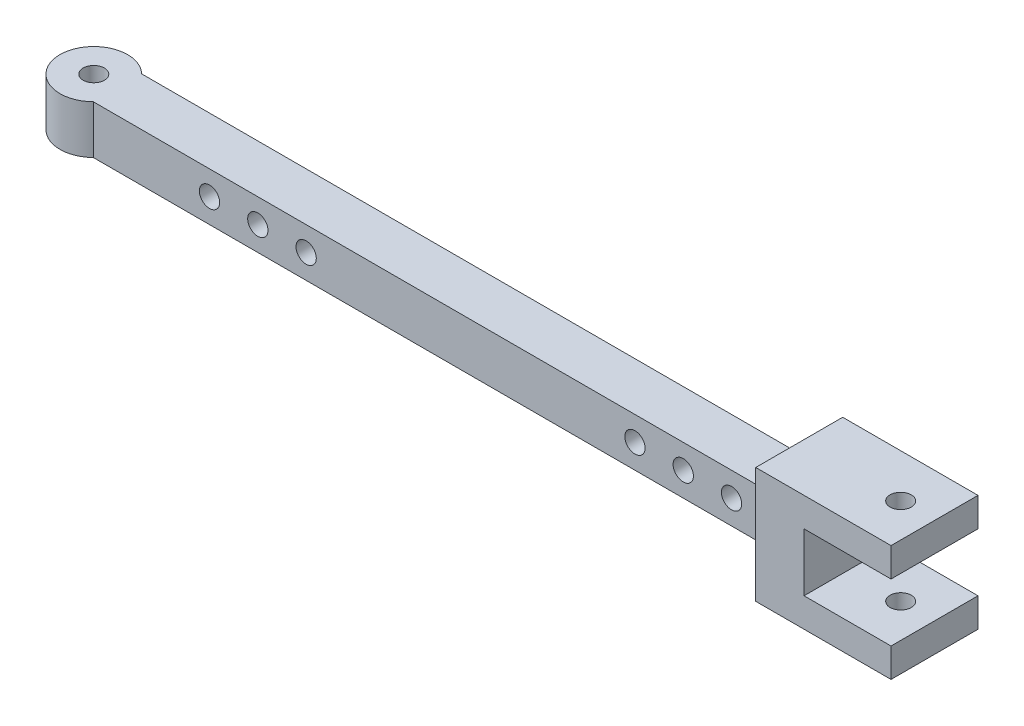
from build123d import *

# Parameters (mm, degrees)
SKETCH1_W           = 80
SKETCH1_H           = 5
BOSS_EXTRUDE1_DEPTH = 5
BOSS_EXTRUDE4_START = 3.5
SKETCH7_W           = 14
SKETCH7_H           = 9
BOSS_EXTRUDE4_DEPTH = 12
CUT_EXTRUDE5_START  = -3
SKETCH9_W           = 9
SKETCH9_H           = 9
CUT_EXTRUDE5_DEPTH  = 6
SKETCH11_R          = 1.1
CUT_EXTRUDE6_DEPTH  = 12
SKETCH16_R          = 3.5
BOSS_EXTRUDE7_DEPTH = 5
SKETCH15_R          = 1.1
CUT_EXTRUDE9_DEPTH  = 5
SKETCH18_R          = 1.05
CUT_EXTRUDE10_DEPTH = 5


with BuildPart() as part:
    # Sketch1 → Boss-Extrude1 (new body)
    with BuildSketch(Plane(origin=(0, 0, 0), x_dir=(1, 0, 0), z_dir=(0, 1, 0))):
        Rectangle(SKETCH1_W, SKETCH1_H)
    extrude(amount=BOSS_EXTRUDE1_DEPTH)

    # Sketch7 → Boss-Extrude4 (add)
    with BuildSketch(Plane(origin=(0, 5, 0), x_dir=(1, 0, 0), z_dir=(0, 1, 0)).offset(BOSS_EXTRUDE4_START)):
        with Locations((40, 0)):
            Rectangle(SKETCH7_W, SKETCH7_H)
    extrude(amount=-BOSS_EXTRUDE4_DEPTH)

    # Sketch9 → Cut-Extrude5 (cut)
    with BuildSketch(Plane(origin=(0, 8.5, 0), x_dir=(1, 0, 0), z_dir=(0, 1, 0)).offset(CUT_EXTRUDE5_START)):
        with Locations((42.5, 0)):
            Rectangle(SKETCH9_W, SKETCH9_H)
    extrude(amount=-CUT_EXTRUDE5_DEPTH, mode=Mode.SUBTRACT)

    # Sketch11 → Cut-Extrude6 (cut)
    with BuildSketch(Plane(origin=(0, 8.5, 0), x_dir=(1, 0, 0), z_dir=(0, 1, 0))):
        with Locations(Location((43.5, 0, 0), (0, 0, 270))):
            Circle(SKETCH11_R)
    extrude(amount=-CUT_EXTRUDE6_DEPTH, mode=Mode.SUBTRACT)

    # Sketch16 → Boss-Extrude7 (add)
    with BuildSketch(Plane(origin=(0, 5, 0), x_dir=(1, 0, 0), z_dir=(0, 1, 0))):
        with Locations((-40, 0)):
            Circle(SKETCH16_R)
    extrude(amount=-BOSS_EXTRUDE7_DEPTH)

    # Sketch15 → Cut-Extrude9 (cut)
    with BuildSketch(Plane(origin=(0, 5, 0), x_dir=(1, 0, 0), z_dir=(0, 1, 0))):
        with Locations(Location((-40, 0, 0), (0, 0, 270))):
            Circle(SKETCH15_R)
    extrude(amount=-CUT_EXTRUDE9_DEPTH, mode=Mode.SUBTRACT)

    # Sketch18 → Cut-Extrude10 (cut)
    with BuildSketch(Plane.XY.offset(2.5)):
        with Locations((-20.525255129, 2.5)):
            Circle(SKETCH18_R)
        with Locations((23.5, 2.5)):
            Circle(SKETCH18_R)
        with Locations((-25.525255129, 2.5)):
            Circle(SKETCH18_R)
        with Locations((-15.525255129, 2.5)):
            Circle(SKETCH18_R)
        with Locations((18.5, 2.5)):
            Circle(SKETCH18_R)
        with Locations((28.5, 2.5)):
            Circle(SKETCH18_R)
    extrude(amount=-CUT_EXTRUDE10_DEPTH, mode=Mode.SUBTRACT)


solid = part.part
